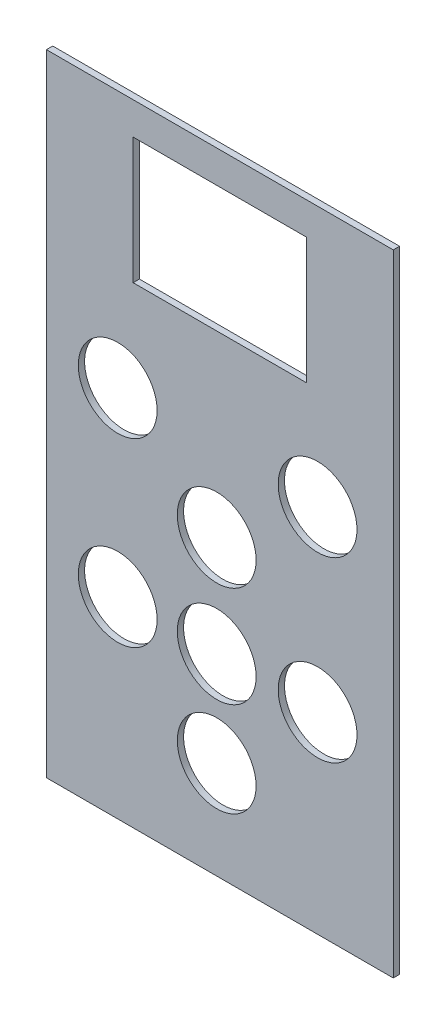
from build123d import *

# Parameters (mm, degrees)
SKETCH_1_W      = 55
SKETCH_1_H      = 100
SKETCH_1_R      = 6.25
SKETCH_1_W_2    = 27.5
SKETCH_1_H_2    = 20
EXTRUDE_1_DEPTH = 1


with BuildPart() as part:
    # 草图1 → 凸台-拉伸1 (new body)
    with BuildSketch(Plane.XY):
        with Locations((37.918181818, -46.951515152)):
            Rectangle(SKETCH_1_W, SKETCH_1_H)
        with Locations((37.418181818, -81.451515152)):
            Circle(SKETCH_1_R, mode=Mode.SUBTRACT)
        with Locations((37.418181818, -66.451515152)):
            Circle(SKETCH_1_R, mode=Mode.SUBTRACT)
        with Locations((21.718181818, -66.451515152)):
            Circle(SKETCH_1_R, mode=Mode.SUBTRACT)
        with Locations((53.418181818, -66.451515152)):
            Circle(SKETCH_1_R, mode=Mode.SUBTRACT)
        with Locations((37.418181818, -50.451515152)):
            Circle(SKETCH_1_R, mode=Mode.SUBTRACT)
        with Locations((53.418181818, -38.251515152)):
            Circle(SKETCH_1_R, mode=Mode.SUBTRACT)
        with Locations((21.718181818, -37.751515152)):
            Circle(SKETCH_1_R, mode=Mode.SUBTRACT)
        with Locations((37.918181818, -12.084434283)):
            Rectangle(SKETCH_1_W_2, SKETCH_1_H_2, mode=Mode.SUBTRACT)
    extrude(amount=EXTRUDE_1_DEPTH)


solid = part.part
